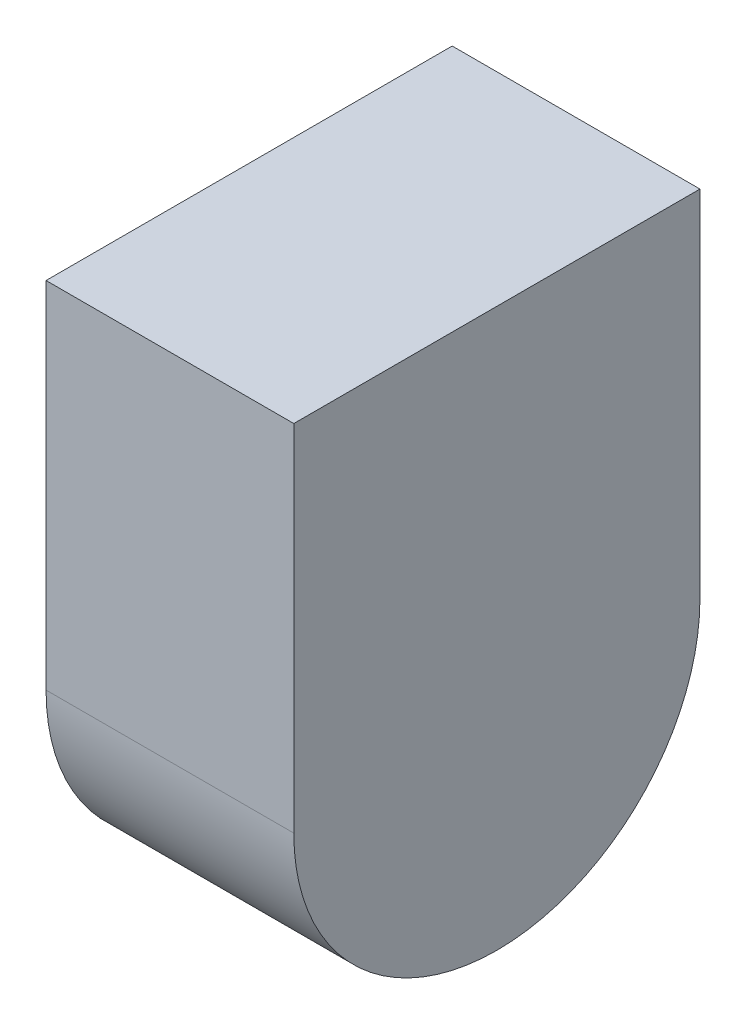
from build123d import *

# Parameters (mm, degrees)
EXTRUDE_1_DEPTH = 1
EXTRUDE_2_DEPTH = 14.6
EXTRUDE_3_DEPTH = 6
EXTRUDE_4_DEPTH = 2.5
EXTRUDE_6_DEPTH = 2.7


with BuildPart() as part:
    # 草图1 → 凸台-拉伸1 (new body)
    with BuildSketch(Plane(origin=(0, 0, 0), x_dir=(0, 0, -1), z_dir=(1, 0, 0))):
        with BuildLine():
            Line((15, 0), (15, 26.2))
            Line((15, 26.2), (-15, 26.2))
            Line((-15, 26.2), (-15, 0))
            ThreePointArc((-15, 0), (0, -15), (15, 0))
        make_face()
    extrude(amount=EXTRUDE_1_DEPTH)

    # 草图2 → 凸台-拉伸2 (add)
    with BuildSketch(Plane(origin=(1, 0, 0), x_dir=(0, 0, -1), z_dir=(1, 0, 0))):
        with BuildLine():
            Line((15, 0), (15, 26.2))
            Line((15, 26.2), (-15, 26.2))
            Line((-15, 26.2), (-15, 0))
            ThreePointArc((-15, 0), (0, -15), (15, 0))
        make_face()
        with BuildLine():
            Line((14, 0), (14, 25.2))
            Line((14, 25.2), (-14, 25.2))
            Line((-14, 25.2), (-14, 0))
            ThreePointArc((-14, 0), (0, -14), (14, 0))
        make_face(mode=Mode.SUBTRACT)
    extrude(amount=EXTRUDE_2_DEPTH)

    # 草图4 → 凸台-拉伸3 (add)
    with BuildSketch(Plane(origin=(3.6, 0, 0), x_dir=(0, 0, -1), z_dir=(1, 0, 0))):
        Polygon((8.5, 8.7), (14, 14.2), (14, 20.2), (-14, 20.2), (-14, 14.2), (-8.5, 8.7), align=None)
    extrude(amount=EXTRUDE_3_DEPTH)

    # 草图5 → 凸台-拉伸4 (add)
    with BuildSketch(Plane(origin=(14.6, 0, 0), x_dir=(0, 0, -1), z_dir=(1, 0, 0))):
        Polygon((14, 14.2), (14, 20.2), (-14, 20.2), (-14, 14.2), (-8.5, 8.7), (8.5, 8.7), align=None)
    extrude(amount=-EXTRUDE_4_DEPTH)

    # 草图6 → 凸台-拉伸6 (add)
    with BuildSketch(Plane(origin=(15.6, 0, 0), x_dir=(0, 0, -1), z_dir=(1, 0, 0))):
        with BuildLine():
            Line((-15, 0), (-15, 26.2))
            Line((-15, 26.2), (15, 26.2))
            Line((15, 26.2), (15, 0))
            ThreePointArc((15, 0), (0, -15), (-15, 0))
        make_face()
    extrude(amount=EXTRUDE_6_DEPTH)


solid = part.part
